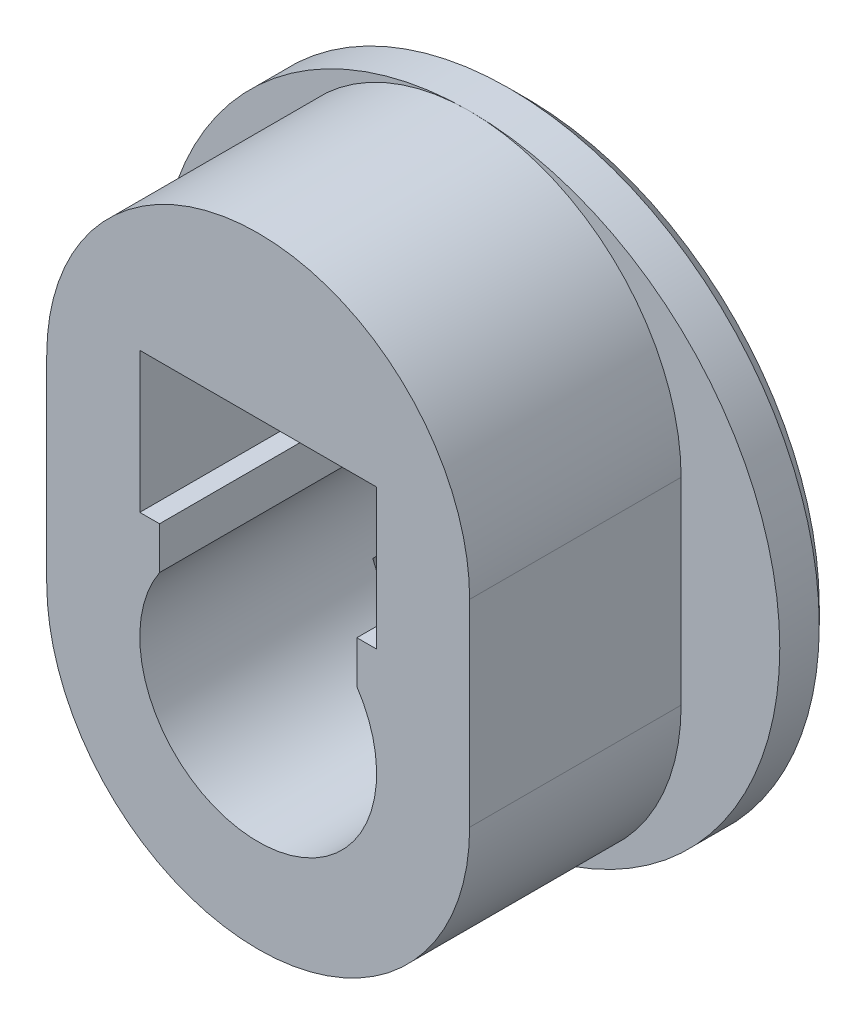
from build123d import *

# Parameters (mm, degrees)
EXTRUDE_1_DEPTH        = 9.5
SKETCH_8_R             = 11
EXTRUDE_2_DEPTH        = 2
CUT_EXTRUDE_1105_DEPTH = 21.530465168
CUT_EXTRUDE_1724_DEPTH = 1.5
CHAMFER_1_SIZE         = 0.6


with BuildPart() as part:
    # Эскиз7 → Бобышка-Вытянуть1 (new body)
    with BuildSketch(Plane.XY):
        with BuildLine():
            Line((-7.5, 0), (-7.5, 7))
            ThreePointArc((-7.5, 7), (0, 14.5), (7.5, 7))
            Line((7.5, 7), (7.5, 0))
            ThreePointArc((7.5, 0), (0, -7.5), (-7.5, 0))
        make_face()
    extrude(amount=EXTRUDE_1_DEPTH)

    # Эскиз8 → Бобышка-Вытянуть2 (add)
    with BuildSketch(Plane(origin=(0, 0, 0), x_dir=(-1, 0, 0), z_dir=(0, 0, -1))):
        with Locations((0, 3.5)):
            Circle(SKETCH_8_R)
    extrude(amount=-EXTRUDE_2_DEPTH)

    # Эскиз3 → Cut-Extrude 1105 (cut, through all)
    with BuildSketch(Plane(origin=(0, 0, 0), x_dir=(-1, 0, 0), z_dir=(0, 0, -1))):
        with BuildLine():
            Line((-4.2, 8.8), (4.2, 8.8))
            Line((4.2, 8.8), (4.2, 3.821637353))
            Line((4.2, 3.821637353), (3.5, 3.821637353))
            Line((3.5, 3.821637353), (3.5, 2.321637353))
            ThreePointArc((3.5, 2.321637353), (0, -4.2), (-3.5, 2.321637353))
            Line((-3.5, 2.321637353), (-3.5, 3.821637353))
            Line((-3.5, 3.821637353), (-4.2, 3.821637353))
            Line((-4.2, 3.821637353), (-4.2, 8.8))
        make_face()
    extrude(amount=-CUT_EXTRUDE_1105_DEPTH, mode=Mode.SUBTRACT)

    # Эскиз6 → Cut-Extrude 1724 (cut)
    with BuildSketch(Plane(origin=(0, 0, 0), x_dir=(-1, 0, 0), z_dir=(0, 0, -1))):
        with BuildLine():
            ThreePointArc((-1.462331642, 3.937205376), (-3.676955262, 3.676955262), (-3.937205376, 1.462331642))
            ThreePointArc((-3.937205376, 1.462331642), (-2.969848481, 2.969848481), (-1.462331642, 3.937205376))
        make_face()
        with BuildLine():
            ThreePointArc((3.937205376, -1.462331642), (3.676955262, -3.676955262), (1.462331642, -3.937205376))
            ThreePointArc((1.462331642, -3.937205376), (2.969848481, -2.969848481), (3.937205376, -1.462331642))
        make_face()
        with BuildLine():
            ThreePointArc((-1.462331642, -3.937205376), (-2.969848481, -2.969848481), (-3.937205376, -1.462331642))
            ThreePointArc((-3.937205376, -1.462331642), (-3.676955262, -3.676955262), (-1.462331642, -3.937205376))
        make_face()
        with BuildLine():
            ThreePointArc((1.462331642, 3.937205376), (2.969848481, 2.969848481), (3.937205376, 1.462331642))
            ThreePointArc((3.937205376, 1.462331642), (3.676955262, 3.676955262), (1.462331642, 3.937205376))
        make_face()
    extrude(amount=-CUT_EXTRUDE_1724_DEPTH, mode=Mode.SUBTRACT)

    # Фаска1
    chamfer_1_edges = [part.edges().sort_by_distance(p)[0] for p in [
        (11, 3.5, 0),
        (4.2, 6.310818677, 0),
        (3.856775231, 3.821637353, 0),
        (-4.2, 6.310818677, 0),
        (0, 8.8, 0),
        (4.2, 0, 0),
        (0, -4.2, 0),
        (-4.2, 0, 0),
        (-3.856775231, 3.821637353, 0),
        (-4.175552206, 2.722821223, 0),
        (3.676955262, -3.676955262, 0),
        (-3.676955262, -3.676955262, 0),
        (4.175552206, 2.722821223, 0),
    ]]
    chamfer(chamfer_1_edges, length=CHAMFER_1_SIZE)


solid = part.part
